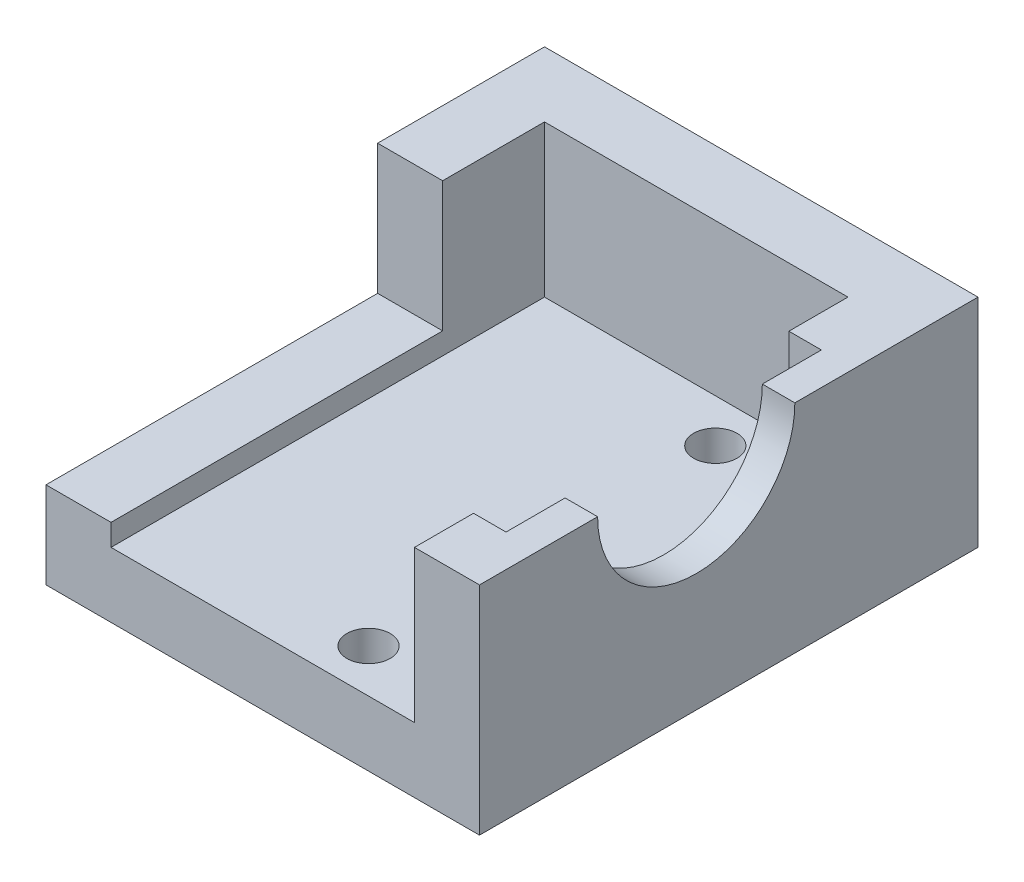
from build123d import *

# Parameters (mm, degrees)
SKETCH1_W           = 20
SKETCH1_H           = 23
BOSS_EXTRUDE1_DEPTH = 10
CUT_EXTRUDE1_DEPTH  = 7
SKETCH4_R           = 4.55
CUT_EXTRUDE6_DEPTH  = 7
SKETCH9_W           = 14.55
SKETCH9_H           = 7
CUT_EXTRUDE8_DEPTH  = 1.5
SKETCH10_W          = 15.3
SKETCH10_H          = 6
CUT_EXTRUDE9_DEPTH  = 5.5
SKETCH11_R          = 1
CUT_EXTRUDE10_DEPTH = 5.5


with BuildPart() as part:
    # Sketch1 → Boss-Extrude1 (new body)
    with BuildSketch(Plane(origin=(0, 0, 0), x_dir=(1, 0, 0), z_dir=(0, 1, 0))):
        Rectangle(SKETCH1_W, SKETCH1_H)
    extrude(amount=BOSS_EXTRUDE1_DEPTH)

    # Sketch3 → Cut-Extrude1 (cut)
    with BuildSketch(Plane(origin=(0, 10, 0), x_dir=(1, 0, 0), z_dir=(0, 1, 0))):
        Polygon((0, -11.5), (-7, -11.5), (-7, 8.5), (7, 8.5), (7, -11.5), align=None)
    extrude(amount=-CUT_EXTRUDE1_DEPTH, mode=Mode.SUBTRACT)

    # Sketch4 → Cut-Extrude6 (cut)
    with BuildSketch(Plane(origin=(10, 0, 0), x_dir=(0, 0, -1), z_dir=(1, 0, 0))):
        with Locations((-1.5, 10)):
            Circle(SKETCH4_R)
    extrude(amount=-CUT_EXTRUDE6_DEPTH, mode=Mode.SUBTRACT)

    # Sketch9 → Cut-Extrude8 (cut)
    with BuildSketch(Plane.ZY.offset(-7)):
        with Locations((1.5, 6.5)):
            Rectangle(SKETCH9_W, SKETCH9_H)
    extrude(amount=-CUT_EXTRUDE8_DEPTH, mode=Mode.SUBTRACT)

    # Sketch10 → Cut-Extrude9 (cut)
    with BuildSketch(Plane.ZY.offset(10)):
        with Locations((3.85, 7)):
            Rectangle(SKETCH10_W, SKETCH10_H)
    extrude(amount=-CUT_EXTRUDE9_DEPTH, mode=Mode.SUBTRACT)

    # Sketch11 → Cut-Extrude10 (cut)
    with BuildSketch(Plane.XZ):
        with Locations(Location((2.88, 9.5, 0), (0, 0, 270))):
            Circle(SKETCH11_R)
        with Locations(Location((2.88, -6.5, 0), (0, 0, 270))):
            Circle(SKETCH11_R)
    extrude(amount=-CUT_EXTRUDE10_DEPTH, mode=Mode.SUBTRACT)


solid = part.part
